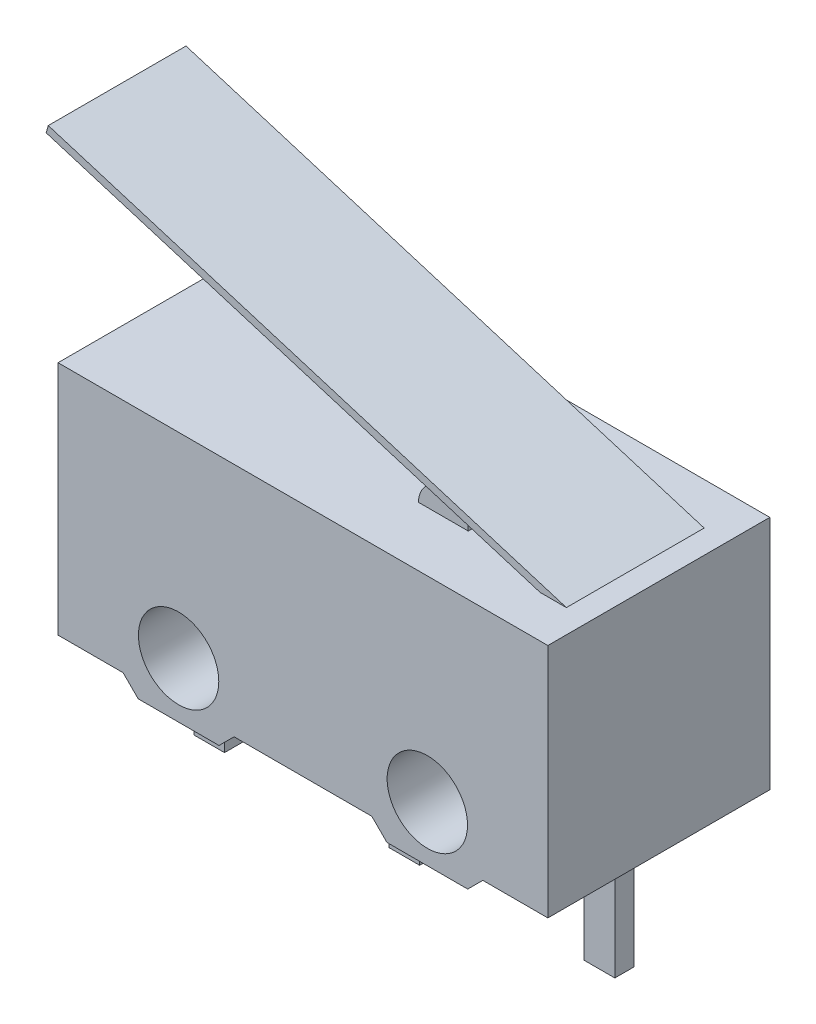
from build123d import *

# Parameters (mm, degrees)
SKETCH_1_R      = 1.05
EXTRUDE_1_DEPTH = 2.9
EXTRUDE_2_DEPTH = 1.35
SKETCH_3_W      = 0.8
SKETCH_3_H      = 3.134296818
EXTRUDE_3_DEPTH = 0.25
EXTRUDE_4_DEPTH = 1.8


with BuildPart() as part:
    # 草图1 → 凸台-拉伸1 (new, symmetric)
    with BuildSketch(Plane.XY):
        Polygon((1.8, 0), (-1.8, 0), (-2.194296818, -0.394296818), (-4.305703182, -0.394296818), (-4.7, 0), (-6.4, 0), (-6.4, 6.165703182), (6.4, 6.165703182), (6.4, 0), (4.7, 0), (4.305703182, -0.394296818), (2.194296818, -0.394296818), align=None)
        with Locations((-3.25, 1.05)):
            Circle(SKETCH_1_R, mode=Mode.SUBTRACT)
        with Locations((3.25, 1.05)):
            Circle(SKETCH_1_R, mode=Mode.SUBTRACT)
    extrude(amount=EXTRUDE_1_DEPTH, both=True)

    # 草图2 → 凸台-拉伸2 (add, symmetric)
    with BuildSketch(Plane.XY):
        with BuildLine():
            Line((1.47, 6.165703182), (2.77, 6.165703182))
            ThreePointArc((2.77, 6.165703182), (2.12, 6.815703182), (1.47, 6.165703182))
        make_face()
    extrude(amount=EXTRUDE_2_DEPTH, both=True)

    # 草图3 → 凸台-拉伸3 (add, symmetric)
    with BuildSketch(Plane.XY):
        with Locations((5.1, -1.567148409)):
            Rectangle(SKETCH_3_W, SKETCH_3_H)
        with Locations((0, -1.567148409)):
            Rectangle(SKETCH_3_W, SKETCH_3_H)
        with Locations((-5.1, -1.567148409)):
            Rectangle(SKETCH_3_W, SKETCH_3_H)
    extrude(amount=EXTRUDE_3_DEPTH, both=True)

    # 草图4 → 凸台-拉伸4 (add, symmetric)
    with BuildSketch(Plane.XY):
        Polygon((-7.755801096, 10.305254362), (5.784060724, 6.165703182), (5.1, 6.165703182), (-7.810114206, 10.112721195), align=None)
    extrude(amount=EXTRUDE_4_DEPTH, both=True)


solid = part.part
